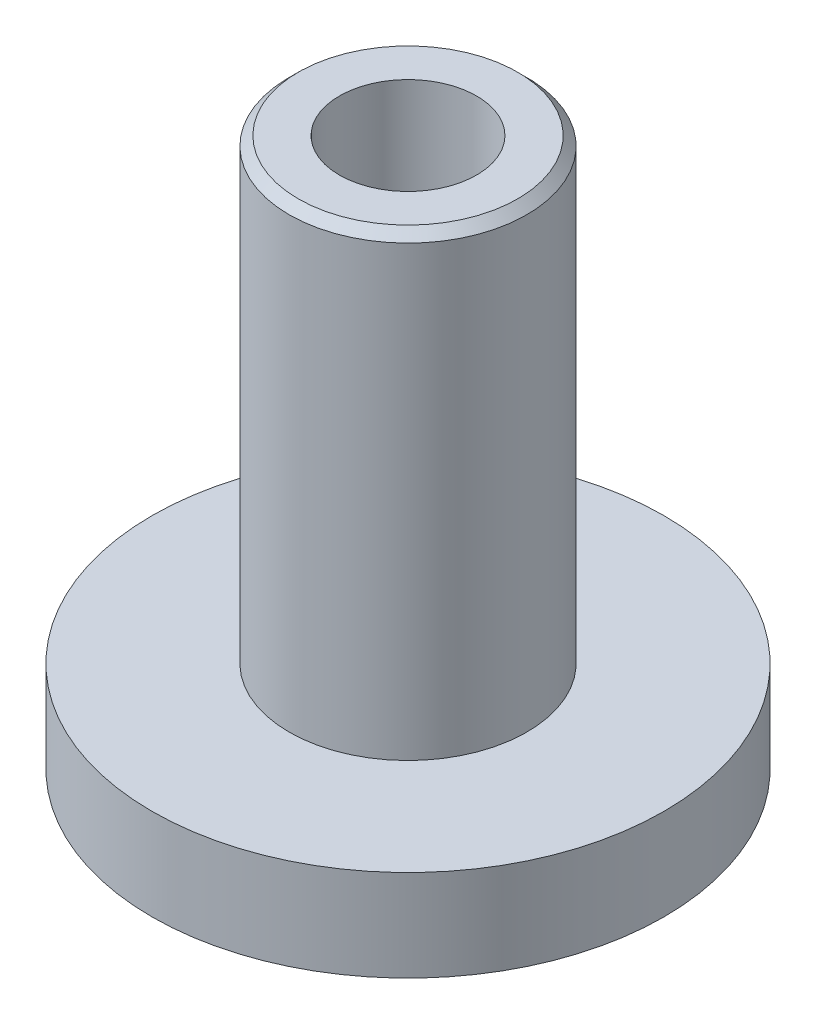
from build123d import *

# Parameters (mm, degrees)
SKETCH_1_R      = 28
EXTRUDE_1_DEPTH = 10
SKETCH_2_R      = 13
SKETCH_2_R_2    = 7.5
EXTRUDE_2_DEPTH = 50
CHAMFER_1_SIZE  = 1


with BuildPart() as part:
    # 草图1 → 凸台-拉伸1 (new body)
    with BuildSketch(Plane(origin=(0, 0, 0), x_dir=(1, 0, 0), z_dir=(0, 1, 0))):
        with Locations(Location((0, 0, 0), (0, 0, 270))):
            Circle(SKETCH_1_R)
    extrude(amount=EXTRUDE_1_DEPTH)

    # 草图2 → 凸台-拉伸2 (add)
    with BuildSketch(Plane(origin=(0, 10, 0), x_dir=(1, 0, 0), z_dir=(0, 1, 0))):
        with Locations(Location((0, 0, 0), (0, 0, 270))):
            Circle(SKETCH_2_R)
        with Locations(Location((0, 0, 0), (0, 0, 270))):
            Circle(SKETCH_2_R_2, mode=Mode.SUBTRACT)
    extrude(amount=EXTRUDE_2_DEPTH)

    # 倒角1
    chamfer_1_edges = [part.edges().sort_by_distance(p)[0] for p in [
        (0, 60, -13),
    ]]
    chamfer(chamfer_1_edges, length=CHAMFER_1_SIZE)


solid = part.part
